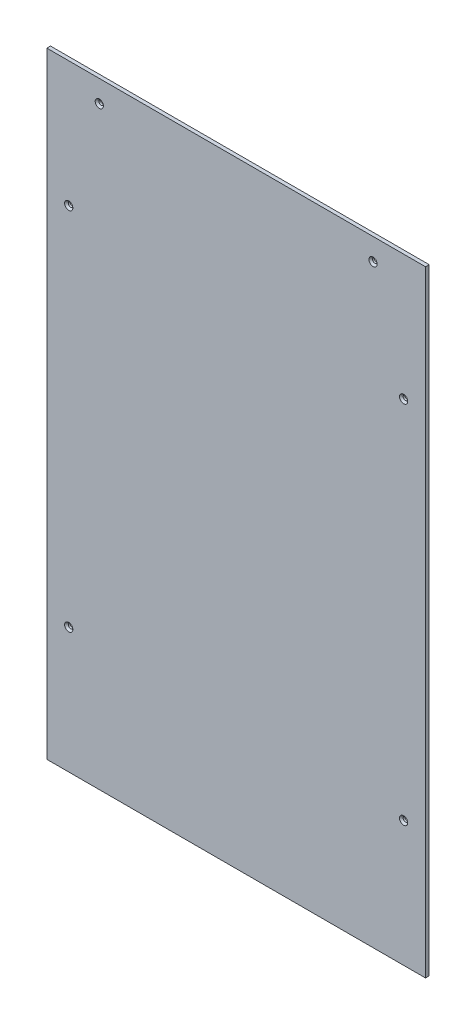
from build123d import *

# Parameters (mm, degrees)
ESQUISSE1_W             = 415
ESQUISSE1_H             = 675
BOSS_EXTRU_1_DEPTH      = 2
ESQUISSE2_R             = 2.5
ENL_V_MAT_EXTRU_1_DEPTH = 397.205123642
CHANFREIN1_SIZE         = 2


with BuildPart() as part:
    # Esquisse1 → Boss.-Extru.1 (new, symmetric)
    with BuildSketch(Plane.XY):
        Rectangle(ESQUISSE1_W, ESQUISSE1_H)
    extrude(amount=BOSS_EXTRU_1_DEPTH, both=True)

    # Esquisse2 → Enlèv. mat.-Extru.1 (cut, through all)
    with BuildSketch(Plane.XY.offset(2)):
        with Locations((183.5, 200)):
            Circle(ESQUISSE2_R)
        with Locations((183.5, -200)):
            Circle(ESQUISSE2_R)
        with Locations((150, 313.5)):
            Circle(ESQUISSE2_R)
        with Locations((-150, 313.5)):
            Circle(ESQUISSE2_R)
        with Locations((-183.5, 200)):
            Circle(ESQUISSE2_R)
        with Locations((-183.5, -200)):
            Circle(ESQUISSE2_R)
    extrude(amount=-ENL_V_MAT_EXTRU_1_DEPTH, mode=Mode.SUBTRACT)

    # Chanfrein1
    chanfrein1_edges = [part.edges().sort_by_distance(p)[0] for p in [
        (181, -200, 2),
        (147.5, 313.5, 2),
        (-152.5, 313.5, 2),
        (-186, 200, 2),
        (-186, -200, 2),
        (181, 200, 2),
    ]]
    chamfer(chanfrein1_edges, length=CHANFREIN1_SIZE)


solid = part.part
